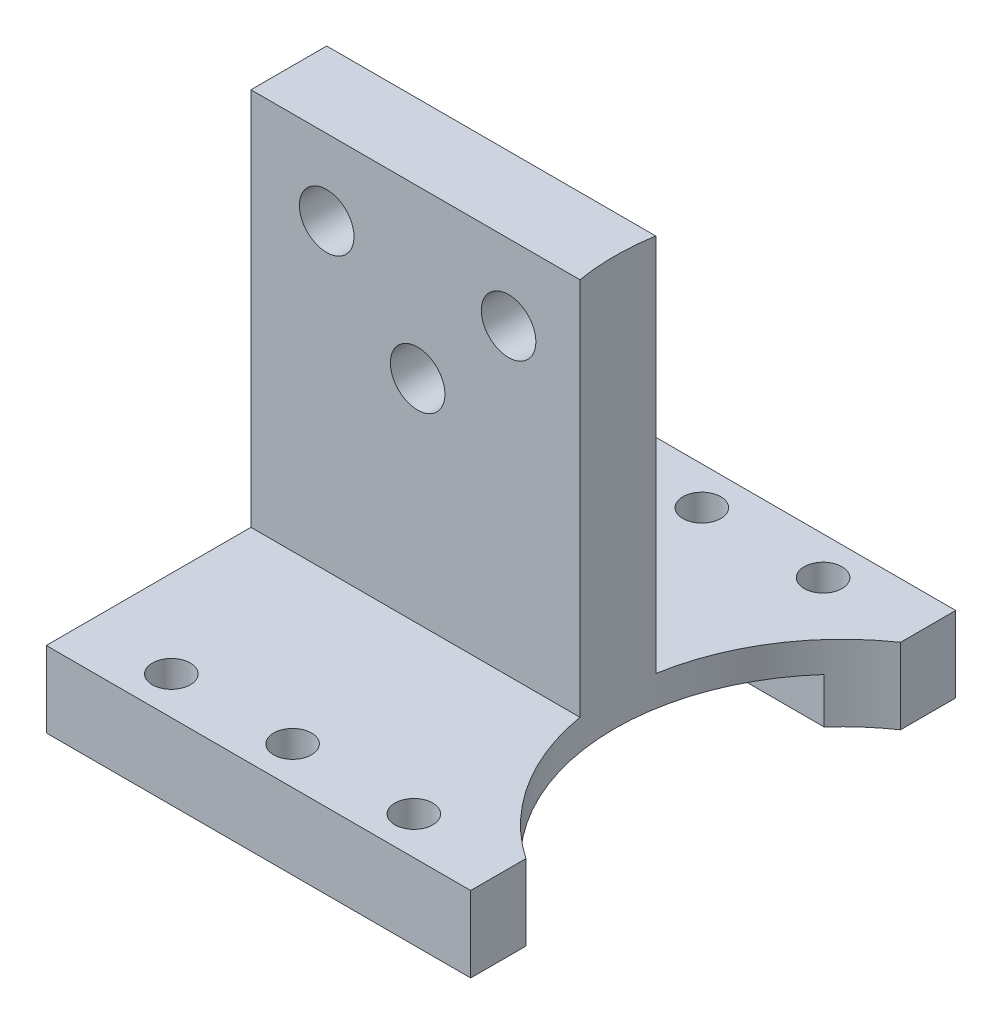
from build123d import *

# Parameters (mm, degrees)
SZKIC1_W                    = 20
SZKIC1_H                    = 20
DODANIE_WYCI_GNI_CIE1_DEPTH = 2
SZKIC3_R                    = 1.25
DODANIE_WYCI_GNI_CIE2_DEPTH = 5
SZKIC4_W                    = 24
SZKIC4_H                    = 5
DODANIE_WYCI_GNI_CIE3_DEPTH = 25
DODANIE_WYCI_GNI_CIE4_DEPTH = 4
SZKIC6_R                    = 15
WYTNIJ_WYCI_GNI_CIE1_DEPTH  = 34
OTW_R_POD_RUB_M31_D         = 3.6
OTW_R_POD_RUB_M31_DEPTH     = 24


with BuildPart() as part:
    # Szkic1 → Dodanie-wyciągnięcie1 (new body)
    with BuildSketch(Plane(origin=(0, 0, 0), x_dir=(1, 0, 0), z_dir=(0, 1, 0))):
        Rectangle(SZKIC1_W, SZKIC1_H)
    extrude(amount=DODANIE_WYCI_GNI_CIE1_DEPTH)

    # Szkic3 → Dodanie-wyciągnięcie2 (add)
    with BuildSketch(Plane(origin=(0, 2, 0), x_dir=(1, 0, 0), z_dir=(0, 1, 0))):
        Polygon((-14, 16), (-14, -16), (10, -16), (10, -10), (-10, -10), (-10, 10), (10, 10), (10, 16), align=None)
        with Locations(Location((-8.25, -13.5, 0), (0, 0, 270))):
            Circle(SZKIC3_R, mode=Mode.SUBTRACT)
        with Locations(Location((-0.25, -13.5, 0), (0, 0, 270))):
            Circle(SZKIC3_R, mode=Mode.SUBTRACT)
        with Locations(Location((7.75, -13.5, 0), (0, 0, 270))):
            Circle(SZKIC3_R, mode=Mode.SUBTRACT)
        with Locations(Location((-8.25, 13.5, 0), (0, 0, 270))):
            Circle(SZKIC3_R, mode=Mode.SUBTRACT)
        with Locations(Location((-0.25, 13.5, 0), (0, 0, 270))):
            Circle(SZKIC3_R, mode=Mode.SUBTRACT)
        with Locations(Location((7.75, 13.5, 0), (0, 0, 270))):
            Circle(SZKIC3_R, mode=Mode.SUBTRACT)
    extrude(amount=-DODANIE_WYCI_GNI_CIE2_DEPTH)

    # Szkic4 → Dodanie-wyciągnięcie3 (add)
    with BuildSketch(Plane(origin=(0, 2, 0), x_dir=(1, 0, 0), z_dir=(0, 1, 0))):
        with Locations((-2, 0)):
            Rectangle(SZKIC4_W, SZKIC4_H)
    extrude(amount=DODANIE_WYCI_GNI_CIE3_DEPTH)

    # Szkic5 → Dodanie-wyciągnięcie4 (add)
    with BuildSketch(Plane(origin=(10, 0, 0), x_dir=(0, 0, -1), z_dir=(1, 0, 0))):
        Polygon((-10, 0), (10, 0), (10, -3), (16, -3), (16, 2), (2.5, 2), (2.5, 27), (-2.5, 27), (-2.5, 2), (-16, 2), (-16, -3), (-10, -3), align=None)
    extrude(amount=DODANIE_WYCI_GNI_CIE4_DEPTH)

    # Szkic6 → Wytnij-wyciągnięcie1 (cut)
    with BuildSketch(Plane(origin=(0, 27, 0), x_dir=(1, 0, 0), z_dir=(0, 1, 0))):
        with Locations((22.5, 0)):
            Circle(SZKIC6_R)
    extrude(amount=-WYTNIJ_WYCI_GNI_CIE1_DEPTH, mode=Mode.SUBTRACT)

    # Otwór pod śrubę M31
    with Locations(Plane.XY.offset(2.5)):
        with Locations((3, 22), (-9, 22), (-3, 16)):
            Hole(OTW_R_POD_RUB_M31_D / 2, depth=OTW_R_POD_RUB_M31_DEPTH)


solid = part.part
